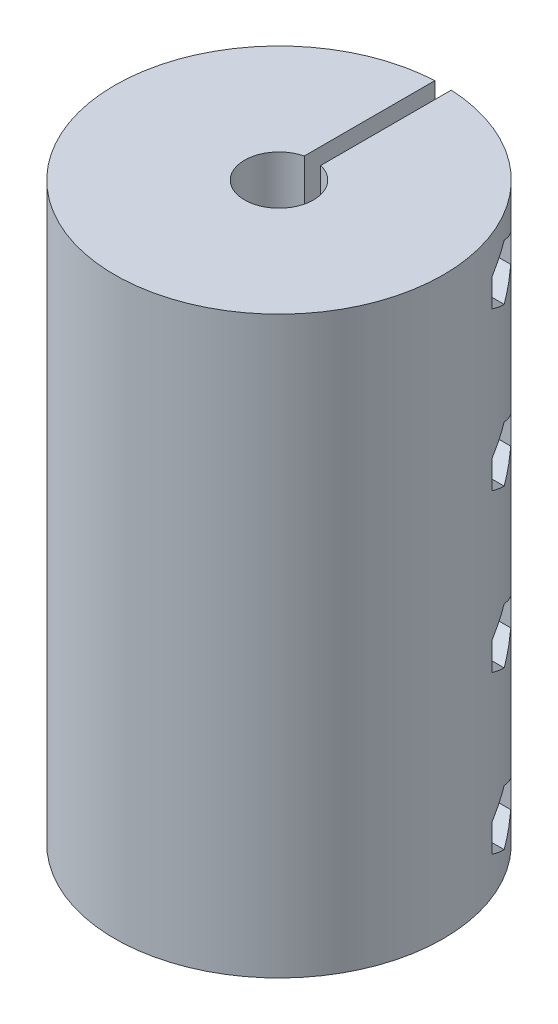
from build123d import *

# Parameters (mm, degrees)
SKETCH1_R           = 20
SKETCH1_R_2         = 4.2
BOSS_EXTRUDE1_DEPTH = 35
SKETCH2_W           = 2
SKETCH2_H           = 25
CUT_EXTRUDE1_DEPTH  = 35
SKETCH4_R           = 1.75
CUT_EXTRUDE2_DEPTH  = 40
CUT_EXTRUDE3_DEPTH  = 11
SKETCH6_R           = 3
CUT_EXTRUDE4_DEPTH  = 11
SKETCH7_R           = 4.35
SKETCH7_R_2         = 3.1
BOSS_EXTRUDE2_DEPTH = 35
SKETCH8_W           = 2
SKETCH8_H           = 8.930849086
CUT_EXTRUDE5_DEPTH  = 50


with BuildPart() as part:
    # Sketch1 → Boss-Extrude1 (new, symmetric)
    with BuildSketch(Plane(origin=(0, 0, 0), x_dir=(1, 0, 0), z_dir=(0, 1, 0))):
        with Locations(Location((0, 0, 0), (0, 0, 270))):
            Circle(SKETCH1_R)
        with Locations(Location((0, 0, 0), (0, 0, 270))):
            Circle(SKETCH1_R_2, mode=Mode.SUBTRACT)
    extrude(amount=BOSS_EXTRUDE1_DEPTH, both=True)

    # Sketch2 → Cut-Extrude1 (cut, symmetric)
    with BuildSketch(Plane(origin=(0, 0, 0), x_dir=(1, 0, 0), z_dir=(0, 1, 0))):
        with Locations((0, 12.5)):
            Rectangle(SKETCH2_W, SKETCH2_H)
    extrude(amount=CUT_EXTRUDE1_DEPTH, both=True, mode=Mode.SUBTRACT)

    # Sketch4 → Cut-Extrude2 (cut)
    with BuildSketch(Plane(origin=(20, 0, 0), x_dir=(0, 0, -1), z_dir=(1, 0, 0))):
        with Locations((10.231687805, 28.75)):
            Circle(SKETCH4_R)
        with Locations((10.231687805, 9.583333333)):
            Circle(SKETCH4_R)
        with Locations((10.231687805, -9.583333333)):
            Circle(SKETCH4_R)
        with Locations((10.231687805, -28.75)):
            Circle(SKETCH4_R)
    extrude(amount=-CUT_EXTRUDE2_DEPTH, mode=Mode.SUBTRACT)

    # Sketch5 → Cut-Extrude3 (cut)
    with BuildSketch(Plane(origin=(20, 0, 0), x_dir=(0, 0, -1), z_dir=(1, 0, 0))):
        Polygon((7.306687805, 7.894583798), (10.231687805, 6.20583426), (13.156687805, 7.894583798), (13.156687805, 11.272082872), (10.231687805, 12.96083241), (7.306687805, 11.272082872), align=None)
        Polygon((10.231687805, 32.127499075), (7.306687805, 30.438749537), (7.306687805, 27.061250463), (10.231687805, 25.372500925), (13.156687805, 27.061250463), (13.156687805, 30.438749537), align=None)
        Polygon((7.306687805, -11.272082868), (10.231687805, -12.960832405), (13.156687805, -11.272082868), (13.156687805, -7.894583793), (10.231687805, -6.205834255), (7.306687805, -7.894583793), align=None)
        Polygon((7.306687805, -30.438749533), (10.231687805, -32.12749907), (13.156687805, -30.438749533), (13.156687805, -27.061250458), (10.231687805, -25.37250092), (7.306687805, -27.061250458), align=None)
    extrude(amount=-CUT_EXTRUDE3_DEPTH, mode=Mode.SUBTRACT)

    # Sketch6 → Cut-Extrude4 (cut)
    with BuildSketch(Plane(origin=(-20, 0, 0), x_dir=(0, 0, -1), z_dir=(1, 0, 0))):
        with Locations(Location((10.231687805, 28.75, 0), (0, 0, 180))):
            Circle(SKETCH6_R)
        with Locations(Location((10.231687805, 9.583333333, 0), (0, 0, 180))):
            Circle(SKETCH6_R)
        with Locations(Location((10.231687805, -9.583333333, 0), (0, 0, 180))):
            Circle(SKETCH6_R)
        with Locations(Location((10.231687805, -28.75, 0), (0, 0, 180))):
            Circle(SKETCH6_R)
    extrude(amount=CUT_EXTRUDE4_DEPTH, mode=Mode.SUBTRACT)

    # Sketch7 → Boss-Extrude2 (add)
    with BuildSketch(Plane.XZ.offset(35)):
        Circle(SKETCH7_R)
        with Locations(Location((0, 0, 0), (0, 0, 270))):
            Circle(SKETCH7_R_2, mode=Mode.SUBTRACT)
    extrude(amount=-BOSS_EXTRUDE2_DEPTH)

    # Sketch8 → Cut-Extrude5 (cut)
    with BuildSketch(Plane.XZ.offset(35)):
        with Locations((0, -5.775706359)):
            Rectangle(SKETCH8_W, SKETCH8_H)
    extrude(amount=-CUT_EXTRUDE5_DEPTH, mode=Mode.SUBTRACT)


solid = part.part
